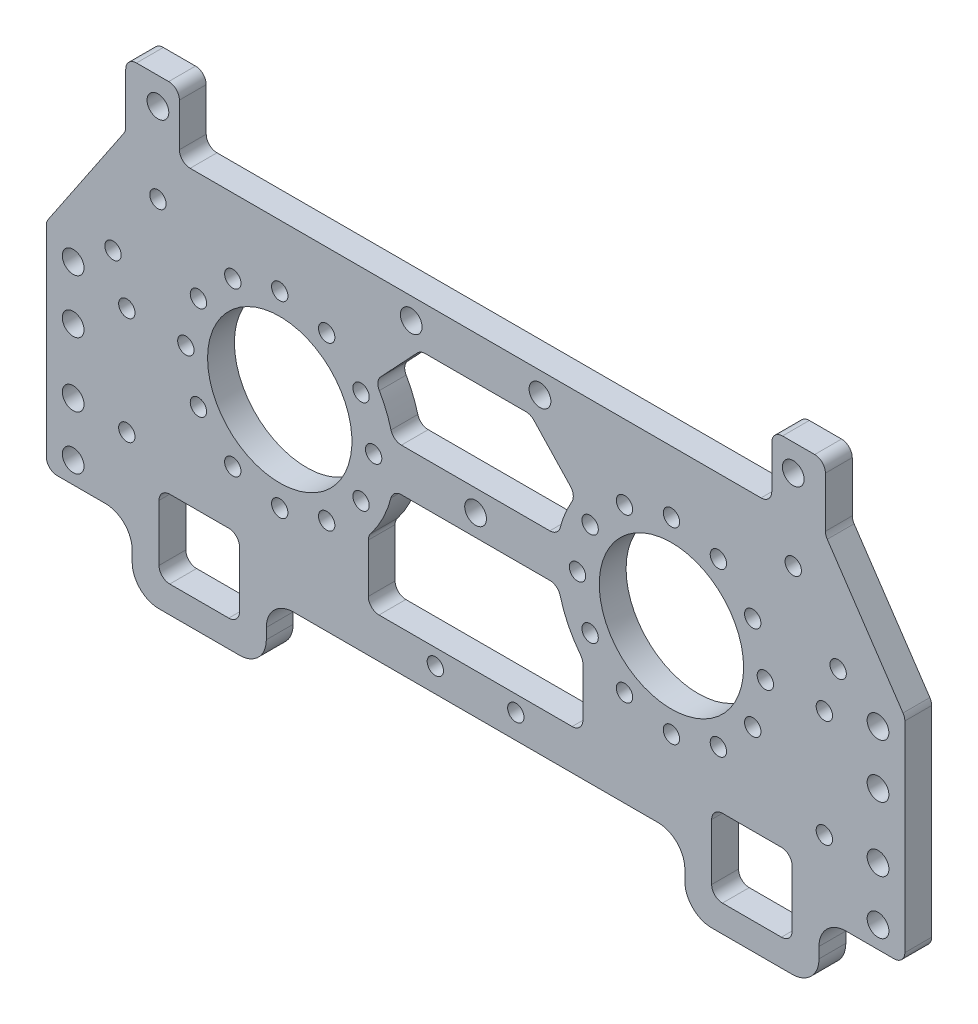
from build123d import *

# Parameters (mm, degrees)
SKETCH_1_W           = 160
SKETCH_1_H           = 60.5
EXTRUDE_1_DEPTH      = 5
SKETCH_2_R           = 13.45
SKETCH_2_R_2         = 1.525
CUT_EXTRUDE_1_DEPTH  = 34
SKETCH_3_R           = 2.025
CUT_EXTRUDE_2_DEPTH  = 10
SKETCH_4_R           = 1.525
CUT_EXTRUDE_3_DEPTH  = 10
SKETCH_5_W           = 160
SKETCH_5_H           = 1.5
EXTRUDE_2_DEPTH      = 5
SKETCH_6_W           = 25
SKETCH_6_H           = 24
EXTRUDE_3_DEPTH      = 5
FILLET_1_R           = 5
SKETCH_7_W           = 15
SKETCH_7_H           = 14.5
CUT_EXTRUDE_4_DEPTH  = 5
FILLET_2_R           = 2
SKETCH_8_W           = 10
SKETCH_8_H           = 12
EXTRUDE_4_DEPTH      = 5
CUT_EXTRUDE_5_DEPTH  = 5
SKETCH_12_R          = 2.025
CUT_EXTRUDE_6_DEPTH  = 10
CUT_EXTRUDE_7_DEPTH  = 10
CUT_EXTRUDE_8_DEPTH  = 10
FILLET_3_R           = 2
FILLET_4_R           = 2
SKETCH_15_R          = 1.525
CUT_EXTRUDE_9_DEPTH  = 10
SKETCH_16_R          = 2.025
CUT_EXTRUDE_10_DEPTH = 10
SKETCH_17_R          = 1.525
CUT_EXTRUDE_11_DEPTH = 10
SKETCH_19_R          = 2.025
CUT_EXTRUDE_12_DEPTH = 10


with BuildPart() as part:
    # 草图1 → 凸台-拉伸1 (new body)
    with BuildSketch(Plane.XY):
        Rectangle(SKETCH_1_W, SKETCH_1_H)
    extrude(amount=EXTRUDE_1_DEPTH)

    # 草图2 → 切除-拉伸1 (cut)
    with BuildSketch(Plane.XY.offset(5)):
        with Locations((36.5, 1.25)):
            Circle(SKETCH_2_R)
        with Locations((36.5, 18.75)):
            Circle(SKETCH_2_R_2)
        with Locations((45.25, 16.405444566)):
            Circle(SKETCH_2_R_2)
        with Locations((51.655444566, 10)):
            Circle(SKETCH_2_R_2)
        with Locations((54, 1.25)):
            Circle(SKETCH_2_R_2)
        with Locations((51.655444566, -7.5)):
            Circle(SKETCH_2_R_2)
        with Locations((45.25, -13.905444566)):
            Circle(SKETCH_2_R_2)
        with Locations((36.5, -16.25)):
            Circle(SKETCH_2_R_2)
        with Locations((27.75, -13.905444566)):
            Circle(SKETCH_2_R_2)
        with Locations((21.344555434, -7.5)):
            Circle(SKETCH_2_R_2)
        with Locations((19, 1.25)):
            Circle(SKETCH_2_R_2)
        with Locations((21.344555434, 10)):
            Circle(SKETCH_2_R_2)
        with Locations((27.75, 16.405444566)):
            Circle(SKETCH_2_R_2)
    cut_extrude_1 = extrude(amount=-CUT_EXTRUDE_1_DEPTH, mode=Mode.SUBTRACT)

    # 镜向1: 切除-拉伸1 across plane
    add(cut_extrude_1.mirror(Plane(origin=(0, 0, 0), x_dir=(0, 0, 1), z_dir=(1, 0, 0))), mode=Mode.SUBTRACT)

    # 草图3 → 切除-拉伸2 (cut)
    with BuildSketch(Plane.XY.offset(5)):
        with Locations((-12, 26.25)):
            Circle(SKETCH_3_R)
        with Locations((0, 1.25)):
            Circle(SKETCH_3_R)
        with Locations((12, 26.25)):
            Circle(SKETCH_3_R)
    extrude(amount=-CUT_EXTRUDE_2_DEPTH, mode=Mode.SUBTRACT)

    # 草图4 → 切除-拉伸3 (cut)
    with BuildSketch(Plane.XY.offset(5)):
        with Locations((7.5, -27.25)):
            Circle(SKETCH_4_R)
        with Locations((-7.5, -27.25)):
            Circle(SKETCH_4_R)
    extrude(amount=-CUT_EXTRUDE_3_DEPTH, mode=Mode.SUBTRACT)

    # 草图5 → 凸台-拉伸2 (add)
    with BuildSketch(Plane.XY.offset(5)):
        with Locations((0, -31)):
            Rectangle(SKETCH_5_W, SKETCH_5_H)
    extrude(amount=-EXTRUDE_2_DEPTH)

    # 草图6 → 凸台-拉伸3 (add)
    with BuildSketch(Plane.XY.offset(5)):
        with Locations((51.5, -31.75)):
            Rectangle(SKETCH_6_W, SKETCH_6_H)
    extrude_3 = extrude(amount=-EXTRUDE_3_DEPTH)

    # 镜向2: 凸台-拉伸3 across plane
    add(extrude_3.mirror(Plane(origin=(0, 0, 0), x_dir=(0, 0, 1), z_dir=(1, 0, 0))))

    # 圆角1
    fillet_1_edges = [part.edges().sort_by_distance(p)[0] for p in [
        (64, -31.75, 2.5),
        (39, -31.75, 2.5),
        (39, -43.75, 2.5),
        (64, -43.75, 2.5),
        (-64, -31.75, 2.5),
        (-39, -31.75, 2.5),
        (-64, -43.75, 2.5),
        (-39, -43.75, 2.5),
    ]]
    fillet(fillet_1_edges, radius=FILLET_1_R)

    # 草图7 → 切除-拉伸4 (cut)
    with BuildSketch(Plane.XY.offset(5)):
        with Locations((51.5, -31.5)):
            Rectangle(SKETCH_7_W, SKETCH_7_H)
    cut_extrude_4 = extrude(amount=-CUT_EXTRUDE_4_DEPTH, mode=Mode.SUBTRACT)

    # 镜向3: 切除-拉伸4 across plane
    add(cut_extrude_4.mirror(Plane(origin=(0, 0, 0), x_dir=(0, 0, 1), z_dir=(1, 0, 0))), mode=Mode.SUBTRACT)

    # 圆角2
    fillet_2_edges = [part.edges().sort_by_distance(p)[0] for p in [
        (44, -24.25, 2.5),
        (44, -38.75, 2.5),
        (59, -38.75, 2.5),
        (59, -24.25, 2.5),
        (-59, -38.75, 2.5),
        (-59, -24.25, 2.5),
        (-44, -24.25, 2.5),
        (-44, -38.75, 2.5),
    ]]
    fillet(fillet_2_edges, radius=FILLET_2_R)

    # 草图8 → 凸台-拉伸4 (add)
    with BuildSketch(Plane(origin=(0, 0, 0), x_dir=(-1, 0, 0), z_dir=(0, 0, -1))):
        with Locations((-60.2, 36.25)):
            Rectangle(SKETCH_8_W, SKETCH_8_H)
    extrude_4 = extrude(amount=-EXTRUDE_4_DEPTH)

    # 镜向4: 凸台-拉伸4 across plane
    add(extrude_4.mirror(Plane(origin=(0, 0, 0), x_dir=(0, 0, 1), z_dir=(1, 0, 0))))

    # 草图11 → 切除-拉伸5 (cut)
    with BuildSketch(Plane(origin=(0, 0, 0), x_dir=(-1, 0, 0), z_dir=(0, 0, -1))):
        Polygon((-65.2, 30.25), (-80, 8.25), (-80, 30.25), align=None)
        Polygon((80, 30.25), (65.2, 30.25), (80, 8.25), align=None)
    extrude(amount=-CUT_EXTRUDE_5_DEPTH, mode=Mode.SUBTRACT)

    # 草图12 → 切除-拉伸6 (cut)
    with BuildSketch(Plane(origin=(0, 0, 0), x_dir=(-1, 0, 0), z_dir=(0, 0, -1))):
        with Locations((75, 4.25)):
            Circle(SKETCH_12_R)
        with Locations((75, -27.75)):
            Circle(SKETCH_12_R)
        with Locations((-75, -27.75)):
            Circle(SKETCH_12_R)
        with Locations((-75, 4.25)):
            Circle(SKETCH_12_R)
    extrude(amount=-CUT_EXTRUDE_6_DEPTH, mode=Mode.SUBTRACT)

    # 草图13 → 切除-拉伸7 (cut)
    with BuildSketch(Plane(origin=(0, 0, 0), x_dir=(-1, 0, 0), z_dir=(0, 0, -1))):
        with BuildLine():
            Line((-10.269060233, 22.25), (-18.720728361, 13.25))
            ThreePointArc((-18.720728361, 13.25), (-16.665960567, 9.417825889), (-15.426260417, 5.25))
            Line((-15.426260417, 5.25), (15.426260417, 5.25))
            ThreePointArc((15.426260417, 5.25), (16.665960567, 9.417825889), (18.720728361, 13.25))
            Line((18.720728361, 13.25), (10.269060233, 22.25))
            Line((10.269060233, 22.25), (-10.269060233, 22.25))
        make_face()
    extrude(amount=-CUT_EXTRUDE_7_DEPTH, mode=Mode.SUBTRACT)

    # 草图14 → 切除-拉伸8 (cut)
    with BuildSketch(Plane(origin=(0, 0, 0), x_dir=(-1, 0, 0), z_dir=(0, 0, -1))):
        with BuildLine():
            Line((-15.426260417, -2.75), (15.426260417, -2.75))
            ThreePointArc((15.426260417, -2.75), (17.096450252, -7.893563703), (20, -12.455929374))
            Line((20, -12.455929374), (20, -24.25))
            Line((20, -24.25), (-20, -24.25))
            Line((-20, -24.25), (-20, -12.455929374))
            ThreePointArc((-20, -12.455929374), (-17.096450252, -7.893563703), (-15.426260417, -2.75))
        make_face()
    extrude(amount=-CUT_EXTRUDE_8_DEPTH, mode=Mode.SUBTRACT)

    # 圆角3
    fillet_3_edges = [part.edges().sort_by_distance(p)[0] for p in [
        (10.269060233, 22.25, 2.5),
        (-10.269060233, 22.25, 2.5),
        (-18.720728361, 13.25, 2.5),
        (-15.426260417, 5.25, 2.5),
        (15.426260417, 5.25, 2.5),
        (18.720728361, 13.25, 2.5),
        (20, -12.455929374, 2.5),
        (15.426260417, -2.75, 2.5),
        (-15.426260417, -2.75, 2.5),
        (-20, -12.455929374, 2.5),
        (-20, -24.25, 2.5),
        (20, -24.25, 2.5),
    ]]
    fillet(fillet_3_edges, radius=FILLET_3_R)

    # 圆角4
    fillet_4_edges = [part.edges().sort_by_distance(p)[0] for p in [
        (80, -31.75, 2.5),
        (-80, -31.75, 2.5),
        (65.2, 42.25, 2.5),
        (55.2, 42.25, 2.5),
        (55.2, 30.25, 2.5),
        (65.2, 30.25, 2.5),
        (-55.2, 30.25, 2.5),
        (-65.2, 30.25, 2.5),
        (-65.2, 42.25, 2.5),
        (-55.2, 42.25, 2.5),
        (80, 8.25, 2.5),
        (-80, 8.25, 2.5),
    ]]
    fillet(fillet_4_edges, radius=FILLET_4_R)

    # 草图15 → 切除-拉伸9 (cut)
    with BuildSketch(Plane.XY.offset(5)):
        with Locations((-65, 1.750036)):
            Circle(SKETCH_15_R)
        with Locations((-65, -18.249964)):
            Circle(SKETCH_15_R)
        with Locations(Location((65, -18.249964, 0), (0, 0, 180))):
            Circle(SKETCH_15_R)
        with Locations(Location((65, 1.750036, 0), (0, 0, 180))):
            Circle(SKETCH_15_R)
    extrude(amount=-CUT_EXTRUDE_9_DEPTH, mode=Mode.SUBTRACT)

    # 草图16 → 切除-拉伸10 (cut)
    with BuildSketch(Plane(origin=(0, 0, 0), x_dir=(-1, 0, 0), z_dir=(0, 0, -1))):
        with Locations((-59.2, 37.25)):
            Circle(SKETCH_16_R)
    cut_extrude_10 = extrude(amount=-CUT_EXTRUDE_10_DEPTH, mode=Mode.SUBTRACT)

    # 镜向5: 切除-拉伸10 across plane
    add(cut_extrude_10.mirror(Plane(origin=(0, 0, 0), x_dir=(0, 0, 1), z_dir=(1, 0, 0))), mode=Mode.SUBTRACT)

    # 草图17 → 切除-拉伸11 (cut)
    with BuildSketch(Plane(origin=(0, 0, 0), x_dir=(-1, 0, 0), z_dir=(0, 0, -1))):
        with Locations((-59.2, 22.25)):
            Circle(SKETCH_17_R)
        with Locations((-67.572650385, 9.804168347)):
            Circle(SKETCH_17_R)
    cut_extrude_11 = extrude(amount=-CUT_EXTRUDE_11_DEPTH, mode=Mode.SUBTRACT)

    # 镜向6: 切除-拉伸11 across plane
    add(cut_extrude_11.mirror(Plane(origin=(0, 0, 0), x_dir=(0, 0, 1), z_dir=(1, 0, 0))), mode=Mode.SUBTRACT)

    # 草图19 → 切除-拉伸12 (cut)
    with BuildSketch(Plane(origin=(0, 0, 0), x_dir=(-1, 0, 0), z_dir=(0, 0, -1))):
        with Locations((-75, -5.75)):
            Circle(SKETCH_19_R)
        with Locations((-75, -17.75)):
            Circle(SKETCH_19_R)
        with Locations((75, -17.75)):
            Circle(SKETCH_19_R)
        with Locations((75, -5.75)):
            Circle(SKETCH_19_R)
    extrude(amount=-CUT_EXTRUDE_12_DEPTH, mode=Mode.SUBTRACT)


solid = part.part
